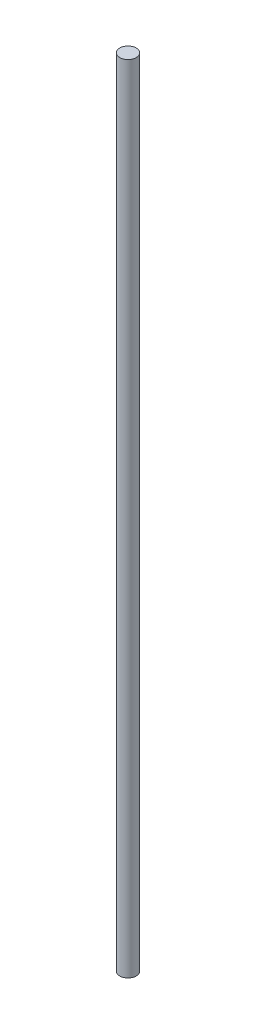
from build123d import *

# Parameters (mm, degrees)
SKETCH1_R           = 9.525
BOSS_EXTRUDE1_DEPTH = 914.4


with BuildPart() as part:
    # Sketch1 → Boss-Extrude1 (new body)
    with BuildSketch(Plane(origin=(0, 0, 0), x_dir=(1, 0, 0), z_dir=(0, 1, 0))):
        with Locations(Location((0, 0, 0), (0, 0, 270))):
            Circle(SKETCH1_R)
    extrude(amount=BOSS_EXTRUDE1_DEPTH)


solid = part.part
